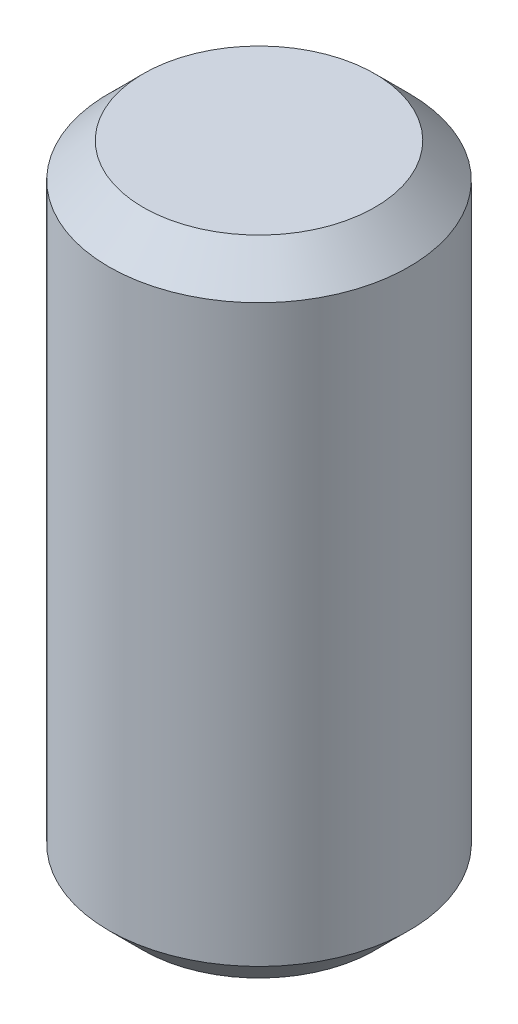
from build123d import *

# Parameters (mm, degrees)
SKETCH1_R           = 3.5
BOSS_EXTRUDE1_DEPTH = 15
CHAMFER1_SIZE       = 0.8


with BuildPart() as part:
    # Sketch1 → Boss-Extrude1 (new body)
    with BuildSketch(Plane(origin=(0, 0, 0), x_dir=(1, 0, 0), z_dir=(0, 1, 0))):
        with Locations(Location((0, 0, 0), (0, 0, 270))):
            Circle(SKETCH1_R)
    extrude(amount=BOSS_EXTRUDE1_DEPTH)

    # Chamfer1
    chamfer1_edges = [part.edges().sort_by_distance(p)[0] for p in [
        (0, 0, -3.5),
        (0, 15, -3.5),
    ]]
    chamfer(chamfer1_edges, length=CHAMFER1_SIZE)


solid = part.part
